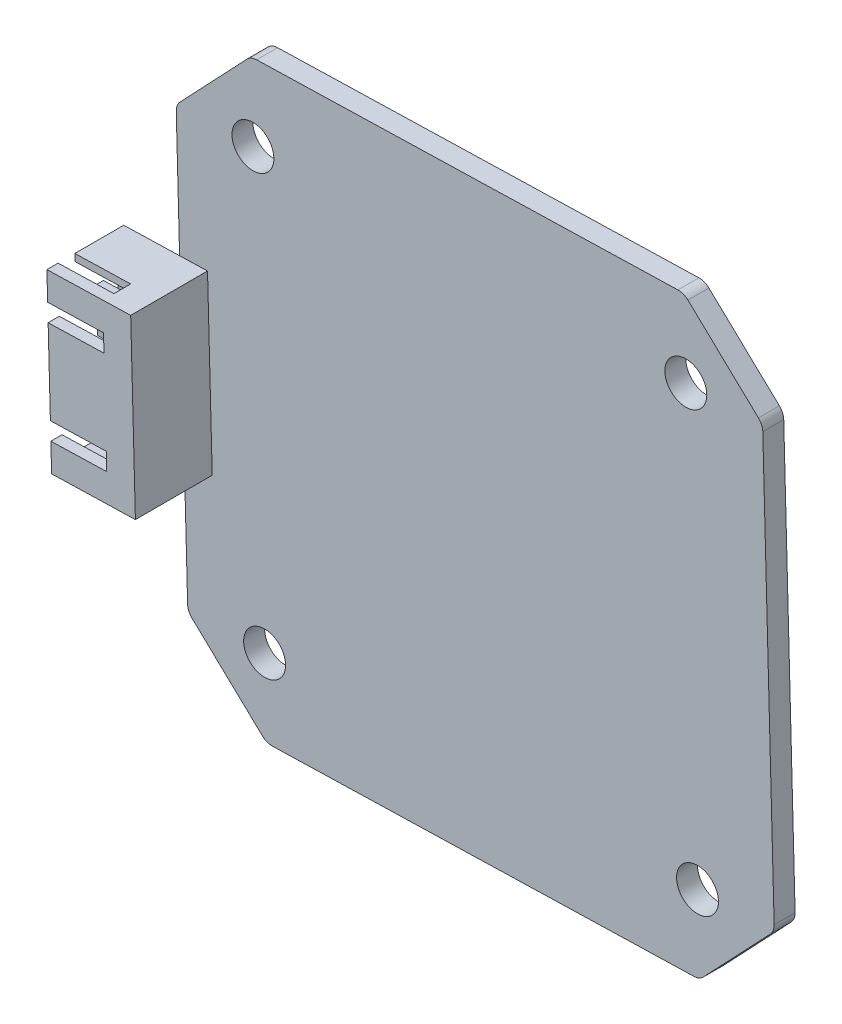
from build123d import *

# Parameters (mm, degrees)
SKETCH_1_R      = 1.5
EXTRUDE_1_DEPTH = 1.5
SKETCH_2_W      = 5.5
SKETCH_2_H      = 12.5
EXTRUDE_2_DEPTH = 2
SKETCH_3_W      = 0.8
SKETCH_3_H      = 2
SKETCH_3_H_2    = 3
EXTRUDE_3_DEPTH = 4
SKETCH_4_W      = 0.5
SKETCH_4_H      = 0.5
EXTRUDE_4_DEPTH = 3


with BuildPart() as part:
    # 草图1 → 凸台-拉伸1 (new body)
    with BuildSketch(Plane.XY):
        with BuildLine():
            Line((-36.284526135, -8.481342061), (-35.853153699, -24.475525936))
            Line((-35.853153699, -24.475525936), (-35.662115389, -31.558736635))
            ThreePointArc((-35.662115389, -31.558736635), (-35.575705149, -31.939228692), (-35.350264491, -32.257689749))
            Line((-35.350264491, -32.257689749), (-30.305346266, -37.037625939))
            ThreePointArc((-30.305346266, -37.037625939), (-29.975196486, -37.245573186), (-29.590599895, -37.31134854))
            Line((-29.590599895, -37.31134854), (0.570005378, -36.497899484))
            ThreePointArc((0.570005378, -36.497899484), (0.950497435, -36.411489244), (1.268958491, -36.186048586))
            Line((1.268958491, -36.186048586), (6.048894681, -31.141130361))
            ThreePointArc((6.048894681, -31.141130361), (6.256841928, -30.810980581), (6.322617283, -30.42638399))
            Line((6.322617283, -30.42638399), (5.509168227, -0.265778718))
            ThreePointArc((5.509168227, -0.265778718), (5.422757987, 0.114713339), (5.197317328, 0.433174396))
            Line((5.197317328, 0.433174396), (0.152399104, 5.213110586))
            ThreePointArc((0.152399104, 5.213110586), (-0.177750677, 5.421057833), (-0.562347267, 5.486833187))
            Line((-0.562347267, 5.486833187), (-30.72295254, 4.673384131))
            ThreePointArc((-30.72295254, 4.673384131), (-31.103444597, 4.586973891), (-31.421905653, 4.361533233))
            Line((-31.421905653, 4.361533233), (-36.201841843, -0.683384991))
            ThreePointArc((-36.201841843, -0.683384991), (-36.40978909, -1.013534772), (-36.475564445, -1.398131363))
            Line((-36.475564445, -1.398131363), (-36.284526135, -8.481342061))
        make_face()
        with Locations((-30.988731257, -0.835784095)):
            Circle(SKETCH_1_R, mode=Mode.SUBTRACT)
        Circle(SKETCH_1_R, mode=Mode.SUBTRACT)
        with Locations((0.835784095, -30.988731257)):
            Circle(SKETCH_1_R, mode=Mode.SUBTRACT)
        with Locations((-30.152947162, -31.824515353)):
            Circle(SKETCH_1_R, mode=Mode.SUBTRACT)
    extrude(amount=EXTRUDE_1_DEPTH)

    # 草图2 → 凸台-拉伸2 (add)
    with BuildSketch(Plane(origin=(-36.486731964, -0.98406837, 0), x_dir=(0, 0, 1), z_dir=(-0.9996364921756676, -0.026960777264883006, 0))):
        with Locations((4.25, -15.5)):
            Rectangle(SKETCH_2_W, SKETCH_2_H)
    extrude(amount=-EXTRUDE_2_DEPTH)

    # 草图3 → 凸台-拉伸3 (add)
    with BuildSketch(Plane(origin=(-36.486731964, -0.98406837, 0), x_dir=(0, 0, 1), z_dir=(-0.9996364921756676, -0.026960777264883006, 0))):
        Polygon((2, -21.25), (2, -15.5), (1.5, -15.5), (1.5, -21.75), (5, -21.75), (5, -21.25), align=None)
        Polygon((1.5, -15.5), (2, -15.5), (2, -9.75), (5, -9.75), (5, -9.25), (1.5, -9.25), align=None)
        with Locations((6.6, -20.75)):
            Rectangle(SKETCH_3_W, SKETCH_3_H)
        with Locations((6.6, -17)):
            Rectangle(SKETCH_3_W, SKETCH_3_H_2)
        with Locations((6.6, -14)):
            Rectangle(SKETCH_3_W, SKETCH_3_H_2)
        with Locations((6.6, -10.25)):
            Rectangle(SKETCH_3_W, SKETCH_3_H)
    extrude(amount=EXTRUDE_3_DEPTH)

    # 草图4 → 凸台-拉伸4 (add)
    with BuildSketch(Plane(origin=(-36.486731964, -0.98406837, 0), x_dir=(0, 0, 1), z_dir=(-0.9996364921756676, -0.026960777264883006, 0))):
        with Locations((4.25, -19.822060647)):
            Rectangle(SKETCH_4_W, SKETCH_4_H)
        with Locations((4.25, -17.198296527)):
            Rectangle(SKETCH_4_W, SKETCH_4_H)
        with Locations((4.25, -13.801703473)):
            Rectangle(SKETCH_4_W, SKETCH_4_H)
        with Locations((4.25, -11.177939353)):
            Rectangle(SKETCH_4_W, SKETCH_4_H)
    extrude(amount=EXTRUDE_4_DEPTH)


solid = part.part
